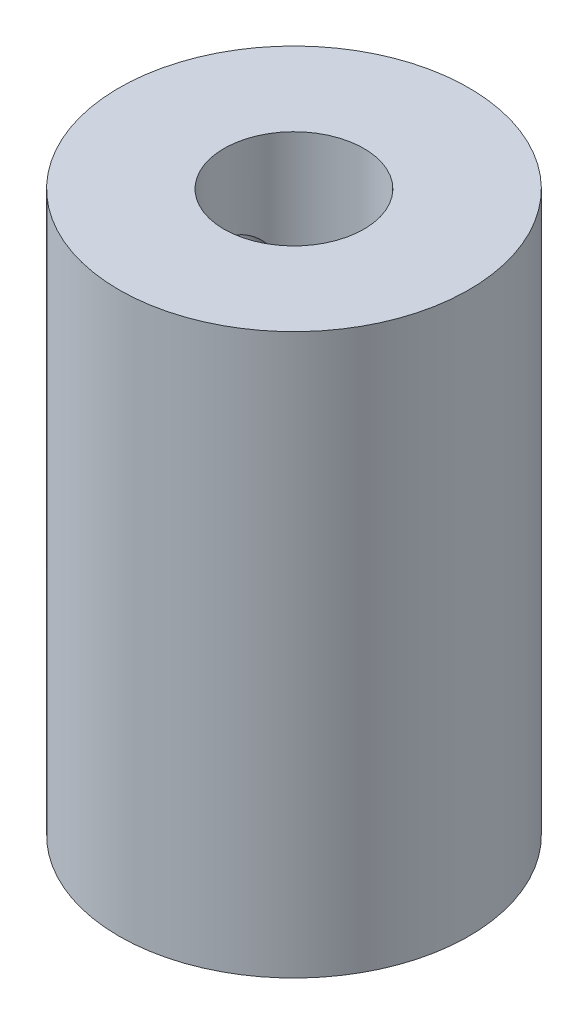
from build123d import *

# Parameters (mm, degrees)
SKETCH1_R              = 5
SKETCH1_R_2            = 2.1
BOSS_EXTRUDE1_DEPTH    = 8
SKETCH2_R              = 5
SKETCH2_R_2            = 2
BOSS_EXTRUDE2_DEPTH    = 8
M3_TAPPED_HOLE2_REACH  = 21.519
M3_TAPPED_HOLE2_BORE_R = 1.25


with BuildPart() as part:
    # Sketch1 → Boss-Extrude1 (new body)
    with BuildSketch(Plane(origin=(0, 0, 0), x_dir=(1, 0, 0), z_dir=(0, 1, 0))):
        with Locations(Location((0, 0, 0), (0, 0, 270))):
            Circle(SKETCH1_R)
        with Locations(Location((0, 0, 0), (0, 0, 270))):
            Circle(SKETCH1_R_2, mode=Mode.SUBTRACT)
    extrude(amount=BOSS_EXTRUDE1_DEPTH)

    # Sketch2 → Boss-Extrude2 (add)
    with BuildSketch(Plane(origin=(0, 8, 0), x_dir=(1, 0, 0), z_dir=(0, 1, 0))):
        with Locations(Location((0, 0, 0), (0, 0, 270))):
            Circle(SKETCH2_R)
        with Locations(Location((0, 0, 0), (0, 0, 270))):
            Circle(SKETCH2_R_2, mode=Mode.SUBTRACT)
    extrude(amount=BOSS_EXTRUDE2_DEPTH)

    # M3 Tapped Hole2 bore → M3 Tapped Hole2 (cut, up to next)
    with BuildSketch(Plane.ZY.offset(5), mode=Mode.PRIVATE) as m3_tapped_hole2_sk1:
        with Locations((0, 12.5)):
            Circle(M3_TAPPED_HOLE2_BORE_R)
    m3_tapped_hole2_tool1 = extrude(m3_tapped_hole2_sk1.sketch, amount=-M3_TAPPED_HOLE2_REACH, mode=Mode.PRIVATE) & part.part
    # M3 Tapped Hole2 bore → M3 Tapped Hole2 (cut, up to next)
    with BuildSketch(Plane.ZY.offset(5), mode=Mode.PRIVATE) as m3_tapped_hole2_sk2:
        with Locations((0, 3.5)):
            Circle(M3_TAPPED_HOLE2_BORE_R)
    m3_tapped_hole2_tool2 = extrude(m3_tapped_hole2_sk2.sketch, amount=-M3_TAPPED_HOLE2_REACH, mode=Mode.PRIVATE) & part.part
    add(m3_tapped_hole2_tool1.solids().sort_by_distance((-5, 12.5, 0))[0], mode=Mode.SUBTRACT)
    add(m3_tapped_hole2_tool2.solids().sort_by_distance((-5, 3.5, 0))[0], mode=Mode.SUBTRACT)


solid = part.part
